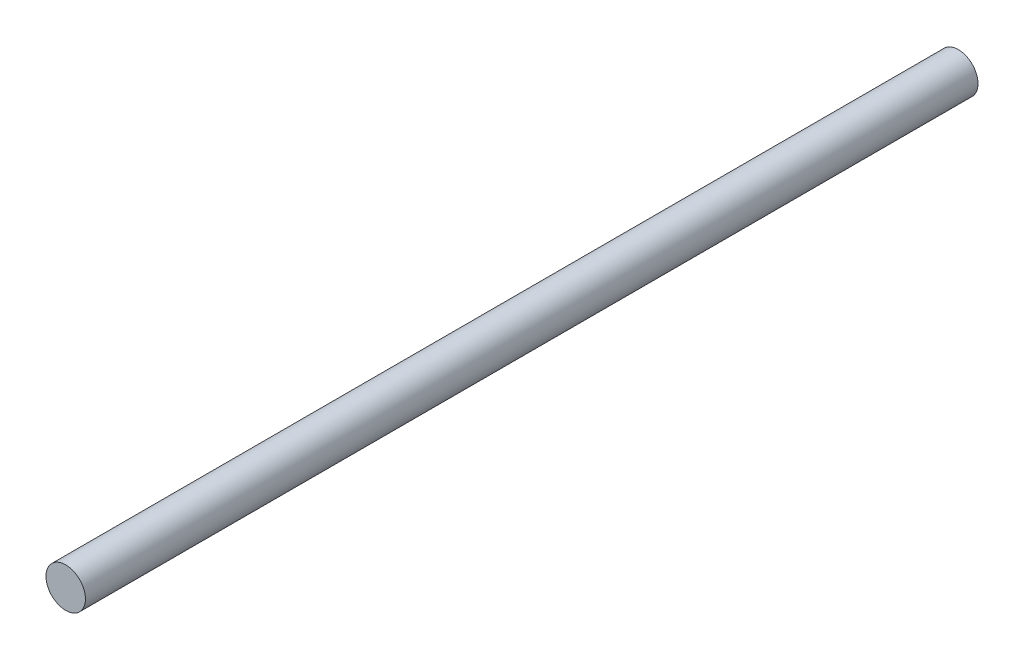
from build123d import *

# Parameters (mm, degrees)
SKETCH1_R           = 2.5
BOSS_EXTRUDE1_DEPTH = 113


with BuildPart() as part:
    # Sketch1 → Boss-Extrude1 (new body)
    with BuildSketch(Plane.XY):
        Circle(SKETCH1_R)
    extrude(amount=BOSS_EXTRUDE1_DEPTH)


solid = part.part
